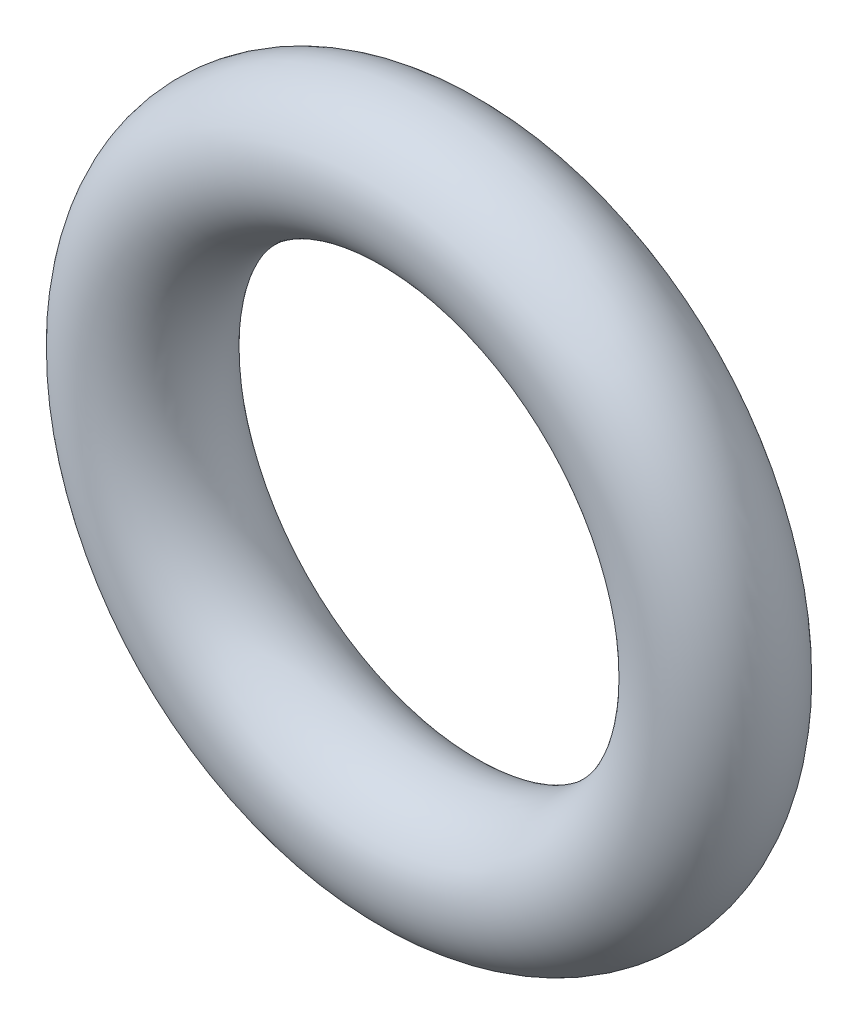
from build123d import *

# Parameters (mm, degrees)
SWEEP1_PROFILE_R = 0.5


with BuildPart() as part:
    # Sweep1: sweep along a path in Sketch1
    with BuildLine(Plane.XY) as sweep1_path:
        CenterArc((0, 0), 2.1, 0, 360)
    # Sweep1 profile (on start of the path) → Sweep1 (sweep)
    with BuildSketch(Plane(origin=(2.1, 0, 0), x_dir=(0, 0, 1), z_dir=(0, 1, 0))):
        Circle(SWEEP1_PROFILE_R)
    sweep(path=sweep1_path.line)


solid = part.part
